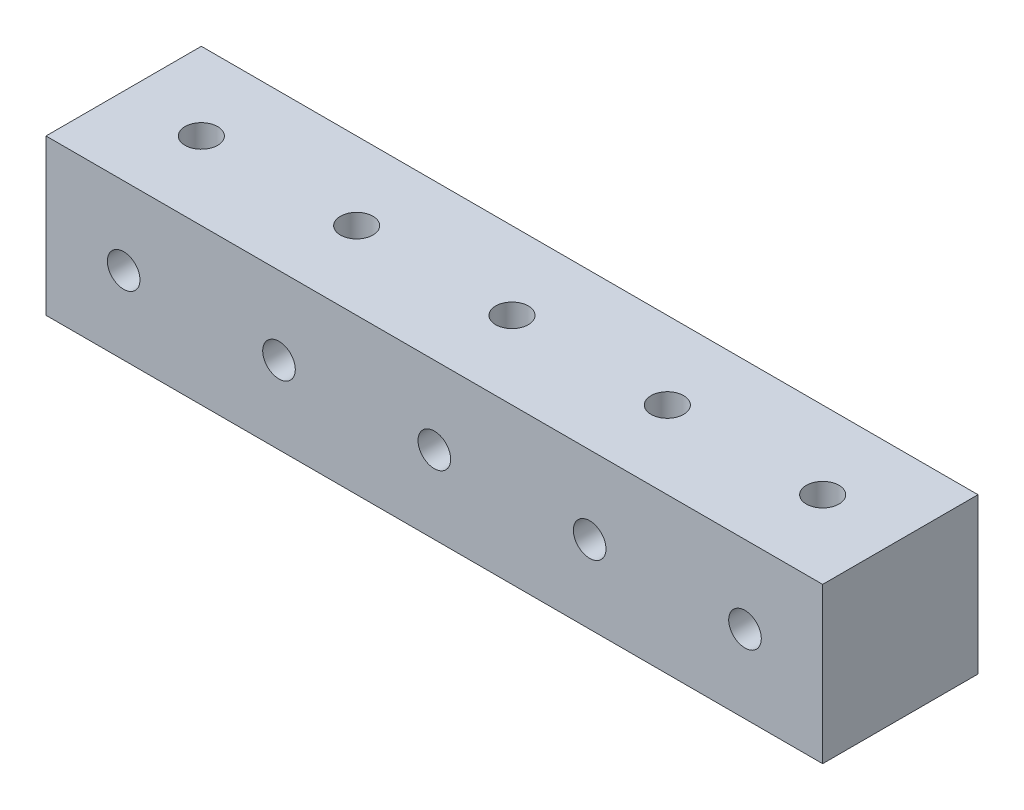
from build123d import *

# Parameters (mm, degrees)
SKETCH_1_W          = 20
SKETCH_1_H          = 20
EXTRUDE_1_DEPTH     = 100
SKETCH_2_R          = 2.1
CUT_EXTRUDE_1_DEPTH = 100
SKETCH_3_R          = 2.1
CUT_EXTRUDE_2_DEPTH = 103.46950766


with BuildPart() as part:
    # 草图1 → 凸台-拉伸1 (new body)
    with BuildSketch(Plane(origin=(0, 0, 0), x_dir=(0, 0, -1), z_dir=(1, 0, 0))):
        Rectangle(SKETCH_1_W, SKETCH_1_H)
    extrude(amount=EXTRUDE_1_DEPTH)

    # 草图2 → 切除-拉伸1 (cut)
    with BuildSketch(Plane.XY.offset(10)):
        with Locations((10, 0)):
            Circle(SKETCH_2_R)
        with Locations((30, 0)):
            Circle(SKETCH_2_R)
        with Locations((50, 0)):
            Circle(SKETCH_2_R)
        with Locations((70, 0)):
            Circle(SKETCH_2_R)
        with Locations((90, 0)):
            Circle(SKETCH_2_R)
    extrude(amount=-CUT_EXTRUDE_1_DEPTH, mode=Mode.SUBTRACT)

    # 草图3 → 切除-拉伸2 (cut, through all)
    with BuildSketch(Plane(origin=(0, 10, 0), x_dir=(1, 0, 0), z_dir=(0, 1, 0))):
        with Locations(Location((10, 0, 0), (0, 0, 270))):
            Circle(SKETCH_3_R)
        with Locations(Location((30, 0, 0), (0, 0, 270))):
            Circle(SKETCH_3_R)
        with Locations(Location((50, 0, 0), (0, 0, 270))):
            Circle(SKETCH_3_R)
        with Locations(Location((70, 0, 0), (0, 0, 270))):
            Circle(SKETCH_3_R)
        with Locations(Location((90, 0, 0), (0, 0, 270))):
            Circle(SKETCH_3_R)
    extrude(amount=-CUT_EXTRUDE_2_DEPTH, mode=Mode.SUBTRACT)


solid = part.part
